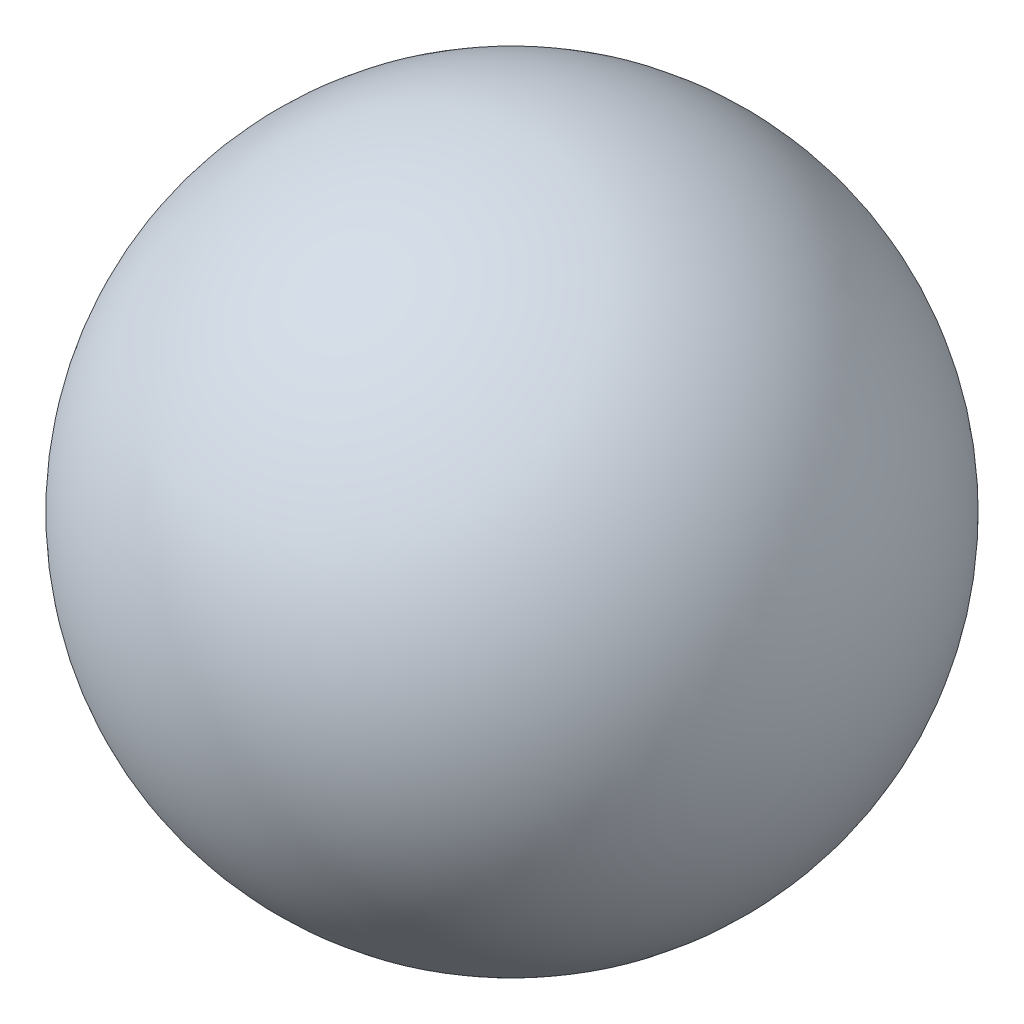
from build123d import *


with BuildPart() as part:
    # Эскиз1 → Повернуть1 (revolve)
    with BuildSketch(Plane(origin=(0, 0, 0), x_dir=(0, 0, -1), z_dir=(1, 0, 0))):
        with BuildLine():
            Line((0, 3.5), (0, -3.5))
            ThreePointArc((0, -3.5), (3.5, 0), (0, 3.5))
        make_face()
    revolve(axis=Axis((0, 17.962001583, 0), (0, -1, 0)))


solid = part.part
